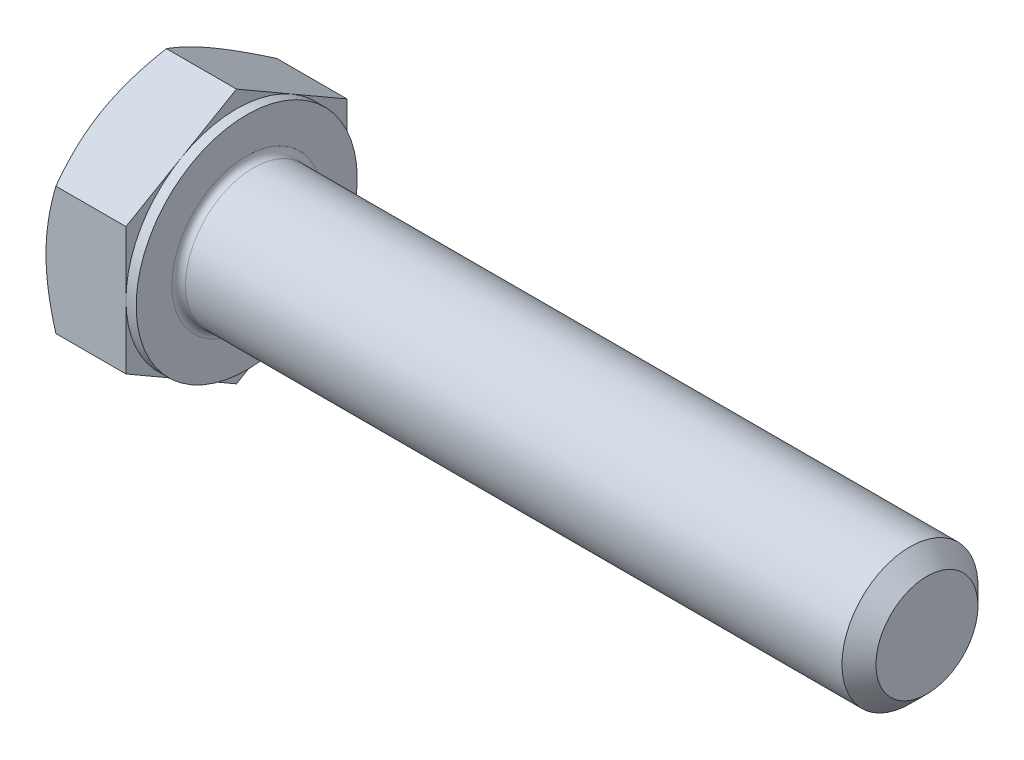
from build123d import *

# Parameters (mm, degrees)
EXTRUDE_371_DEPTH = 5.3
SKETCH_4_W        = 0.6
SKETCH_4_H        = 11.005553499
CHAMFER_2031_SIZE = 1
FILLET_2073_R     = 0.4


with BuildPart() as part:
    # 草图1 → Extrude 371 (new body)
    with BuildSketch(Plane(origin=(0, 0, 0), x_dir=(0, 0, -1), z_dir=(1, 0, 0))):
        Polygon((6.5, 3.75277675), (6.5, -3.75277675), (0, -7.505553499), (-6.5, -3.75277675), (-6.5, 3.75277675), (0, 7.505553499), align=None)
    extrude(amount=EXTRUDE_371_DEPTH)

    # 草图2 → 凸台-旋转1 (revolve)
    with BuildSketch(Plane.XY, mode=Mode.PRIVATE) as revolve_1_sk:
        Polygon((0, 0), (45.3, 0), (45.3, 2.9175), (45.3, 4), (27.8072, 4), (0, 4), align=None)
    revolve(revolve_1_sk.sketch.rotate(Axis((0, 0, 0), (1, 0, 0)), 90), axis=Axis((0, 0, 0), (1, 0, 0)))

    # 草图3 → 切除-旋转1 (revolve, cut)
    with BuildSketch(Plane.XY):
        Polygon((0, 6.5), (3.46730793, 12.505553499), (3.46730793, 17.505553499), (-10, 17.505553499), (-10, 6.5), align=None)
    revolve(axis=Axis((0, 0, 0), (1, 0, 0)), mode=Mode.SUBTRACT)

    # 草图5 → 切除-旋转2 (revolve, cut)
    with BuildSketch(Plane.XY):
        Polygon((5.3, 6.5), (1.83269207, 12.505553499), (1.83269207, 17.505553499), (11.83269207, 17.505553499), (11.83269207, 6.5), align=None)
    revolve(axis=Axis((0, 0, 0), (1, 0, 0)), mode=Mode.SUBTRACT)

    # 草图4 → 切除-旋转3 (revolve, cut)
    with BuildSketch(Plane.XY, mode=Mode.PRIVATE) as cut_revolve_3_sk:
        with Locations((5, 12.00277675)):
            Rectangle(SKETCH_4_W, SKETCH_4_H)
    revolve(cut_revolve_3_sk.sketch.rotate(Axis((0, 0, 0), (1, 0, 0)), 270), axis=Axis((0, 0, 0), (1, 0, 0)), mode=Mode.SUBTRACT)

    # Chamfer 2031
    chamfer_2031_edges = [part.edges().sort_by_distance(p)[0] for p in [
        (45.3, 0, -4),
    ]]
    chamfer(chamfer_2031_edges, length=CHAMFER_2031_SIZE)

    # Fillet 2073
    fillet_2073_edges = [part.edges().sort_by_distance(p)[0] for p in [
        (5.3, 0, -4),
    ]]
    fillet(fillet_2073_edges, radius=FILLET_2073_R)


solid = part.part
